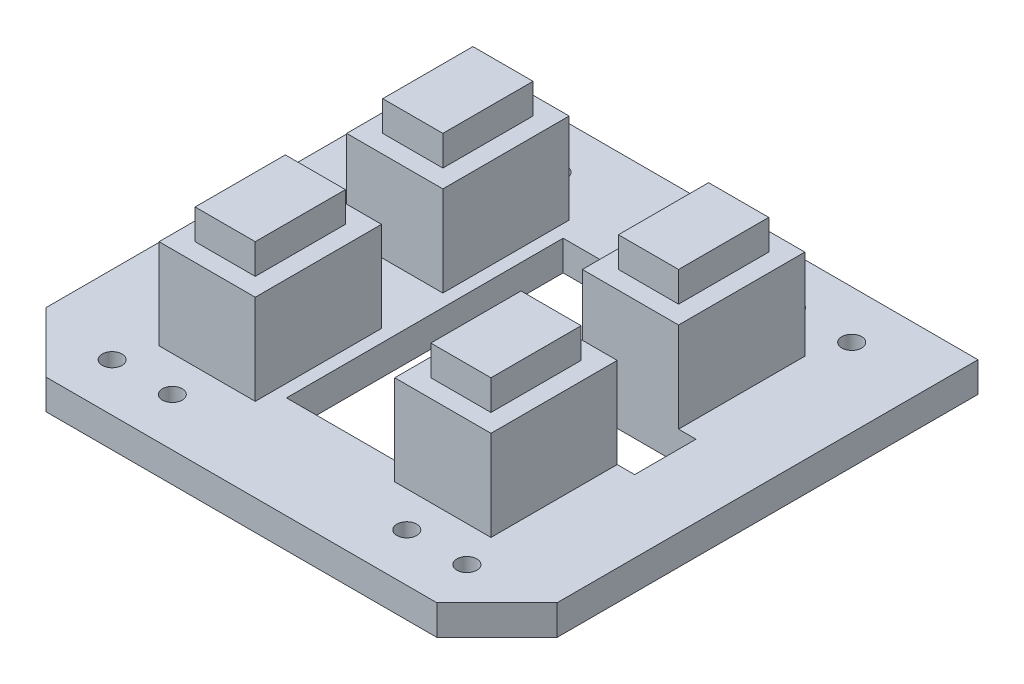
from build123d import *

# Parameters (mm, degrees)
SKETCH1_R           = 1.65
SKETCH1_W           = 19
SKETCH1_H           = 46
BOSS_EXTRUDE3_DEPTH = 5
CHAMFER1_SIZE       = 10
SKETCH6_W           = 10
SKETCH6_H           = 15
BOSS_EXTRUDE4_DEPTH = 20
SKETCH8_W           = 16
SKETCH8_H           = 21
SKETCH8_W_2         = 10
SKETCH8_H_2         = 15
BOSS_EXTRUDE5_DEPTH = 15
SKETCH5_W           = 16
SKETCH5_H           = 10.2
CUT_EXTRUDE1_DEPTH  = 64.492125496


with BuildPart() as part:
    # Sketch1 → Boss-Extrude3 (new body)
    with BuildSketch(Plane(origin=(0, 0, 0), x_dir=(1, 0, 0), z_dir=(0, 1, 0))):
        Polygon((42.5, 40), (-42.5, 40), (-42.5, 24.25), (-42.5, -24.25), (-42.5, -40), (-20, -40), (20, -40), (42.5, -40), (42.5, -24.25), (42.5, 24.25), align=None)
        with Locations(Location((-29.5, -32, 0), (0, 0, 270))):
            Circle(SKETCH1_R, mode=Mode.SUBTRACT)
        with Locations(Location((-19.5, -32, 0), (0, 0, 270))):
            Circle(SKETCH1_R, mode=Mode.SUBTRACT)
        with Locations(Location((19.5, -32, 0), (0, 0, 270))):
            Circle(SKETCH1_R, mode=Mode.SUBTRACT)
        with Locations(Location((29.5, -32, 0), (0, 0, 270))):
            Circle(SKETCH1_R, mode=Mode.SUBTRACT)
        Rectangle(SKETCH1_W, SKETCH1_H, mode=Mode.SUBTRACT)
        with Locations(Location((-29.5, 32, 0), (0, 0, 270))):
            Circle(SKETCH1_R, mode=Mode.SUBTRACT)
        with Locations(Location((-19.5, 32, 0), (0, 0, 270))):
            Circle(SKETCH1_R, mode=Mode.SUBTRACT)
        with Locations(Location((19.5, 32, 0), (0, 0, 270))):
            Circle(SKETCH1_R, mode=Mode.SUBTRACT)
        with Locations(Location((29.5, 32, 0), (0, 0, 270))):
            Circle(SKETCH1_R, mode=Mode.SUBTRACT)
    extrude(amount=BOSS_EXTRUDE3_DEPTH)

    # Chamfer1
    chamfer1_edges = [part.edges().sort_by_distance(p)[0] for p in [
        (-42.5, 2.5, 40),
        (42.5, 2.5, 40),
    ]]
    chamfer(chamfer1_edges, length=CHAMFER1_SIZE)

    # Sketch6 → Boss-Extrude4 (add)
    with BuildSketch(Plane(origin=(0, 5, 0), x_dir=(1, 0, 0), z_dir=(0, 1, 0))):
        with Locations((19.6, 15.6)):
            Rectangle(SKETCH6_W, SKETCH6_H)
        with Locations((-19.6, 15.6)):
            Rectangle(SKETCH6_W, SKETCH6_H)
        with Locations((-19.6, -15.6)):
            Rectangle(SKETCH6_W, SKETCH6_H)
        with Locations((19.6, -15.6)):
            Rectangle(SKETCH6_W, SKETCH6_H)
    extrude(amount=BOSS_EXTRUDE4_DEPTH)

    # Sketch8 → Boss-Extrude5 (add)
    # profile 1 of 4: a face of its own
    with BuildSketch(Plane(origin=(0, 5, 0), x_dir=(1, 0, 0), z_dir=(0, 1, 0))):
        with Locations((-19.6, 15.6)):
            Rectangle(SKETCH8_W, SKETCH8_H)
        with Locations((-19.6, 15.6)):
            Rectangle(SKETCH8_W_2, SKETCH8_H_2, mode=Mode.SUBTRACT)
    # profile 2 of 4: a face of its own
    with BuildSketch(Plane(origin=(0, 5, 0), x_dir=(1, 0, 0), z_dir=(0, 1, 0))):
        with Locations((-19.6, -15.6)):
            Rectangle(SKETCH8_W, SKETCH8_H)
        with Locations((-19.6, -15.6)):
            Rectangle(SKETCH8_W_2, SKETCH8_H_2, mode=Mode.SUBTRACT)
    # profile 3 of 4: a face of its own
    with BuildSketch(Plane(origin=(0, 5, 0), x_dir=(1, 0, 0), z_dir=(0, 1, 0))):
        with Locations((19.6, -15.6)):
            Rectangle(SKETCH8_W, SKETCH8_H)
        with Locations((19.6, -15.6)):
            Rectangle(SKETCH8_W_2, SKETCH8_H_2, mode=Mode.SUBTRACT)
    # profile 4 of 4: a face of its own
    with BuildSketch(Plane(origin=(0, 5, 0), x_dir=(1, 0, 0), z_dir=(0, 1, 0))):
        with Locations((19.6, 15.6)):
            Rectangle(SKETCH8_W, SKETCH8_H)
        with Locations((19.6, 15.6)):
            Rectangle(SKETCH8_W_2, SKETCH8_H_2, mode=Mode.SUBTRACT)
    extrude(amount=BOSS_EXTRUDE5_DEPTH)

    # Sketch5 → Cut-Extrude1 (cut, through all)
    with BuildSketch(Plane.XZ):
        with Locations((22.5, 0)):
            Rectangle(SKETCH5_W, SKETCH5_H)
    extrude(amount=-CUT_EXTRUDE1_DEPTH, mode=Mode.SUBTRACT)


solid = part.part
